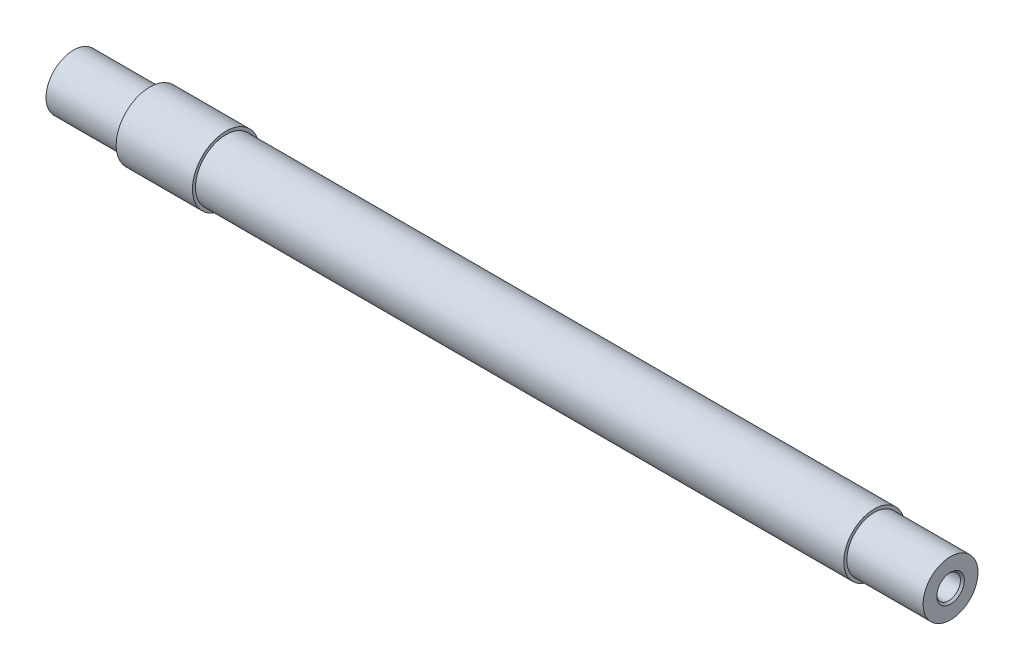
from build123d import *

# Parameters (mm, degrees)
FURO_ROSCADO_DE_M181_D                     = 15.5
FURO_ROSCADO_DE_M181_DEPTH                 = 25
FURO_ROSCADO_DE_M181_CSINK_D               = 18.05
FURO_ROSCADO_DE_M181_CSINK_ANGLE           = 90
FURO_ROSCADO_DE_M181_TIP                   = 4.656669797
FURO_ROSCADO_DE_M181_ON_FACE_2_D           = 15.5
FURO_ROSCADO_DE_M181_ON_FACE_2_DEPTH       = 25
FURO_ROSCADO_DE_M181_ON_FACE_2_CSINK_D     = 18.05
FURO_ROSCADO_DE_M181_ON_FACE_2_CSINK_ANGLE = 90
FURO_ROSCADO_DE_M181_ON_FACE_2_TIP         = 4.656669797


with BuildPart() as part:
    # Esboço1 → Revolução1 (revolve)
    with BuildSketch(Plane.XY):
        Polygon((0, 0), (0, 18), (50, 18), (50, 22), (100, 22), (100, 20), (525, 20), (525, 18), (575, 18), (575, 0), align=None)
    revolve(axis=Axis((575, 0, 0), (-1, 0, 0)))

    # Furo roscado de M181
    with Locations(Plane(origin=(0, 0, 0), x_dir=(0, -1, 0), z_dir=(-1, 0, 0))):
        with Locations((0, 0)):
            CounterSinkHole(FURO_ROSCADO_DE_M181_D / 2, FURO_ROSCADO_DE_M181_CSINK_D / 2, depth=FURO_ROSCADO_DE_M181_DEPTH, counter_sink_angle=FURO_ROSCADO_DE_M181_CSINK_ANGLE)
            with Locations((0, 0, -(FURO_ROSCADO_DE_M181_DEPTH + FURO_ROSCADO_DE_M181_TIP / 2))):  # 118° drill point
                Cone(0, FURO_ROSCADO_DE_M181_D / 2, FURO_ROSCADO_DE_M181_TIP, mode=Mode.SUBTRACT)

    # Furo roscado de M181 on face 2
    with Locations(Plane(origin=(575, 0, 0), x_dir=(0, 0, 1), z_dir=(1, 0, 0))):
        with Locations((0, 0)):
            CounterSinkHole(FURO_ROSCADO_DE_M181_ON_FACE_2_D / 2, FURO_ROSCADO_DE_M181_ON_FACE_2_CSINK_D / 2, depth=FURO_ROSCADO_DE_M181_ON_FACE_2_DEPTH, counter_sink_angle=FURO_ROSCADO_DE_M181_ON_FACE_2_CSINK_ANGLE)
            with Locations((0, 0, -(FURO_ROSCADO_DE_M181_ON_FACE_2_DEPTH + FURO_ROSCADO_DE_M181_ON_FACE_2_TIP / 2))):  # 118° drill point
                Cone(0, FURO_ROSCADO_DE_M181_ON_FACE_2_D / 2, FURO_ROSCADO_DE_M181_ON_FACE_2_TIP, mode=Mode.SUBTRACT)


solid = part.part
